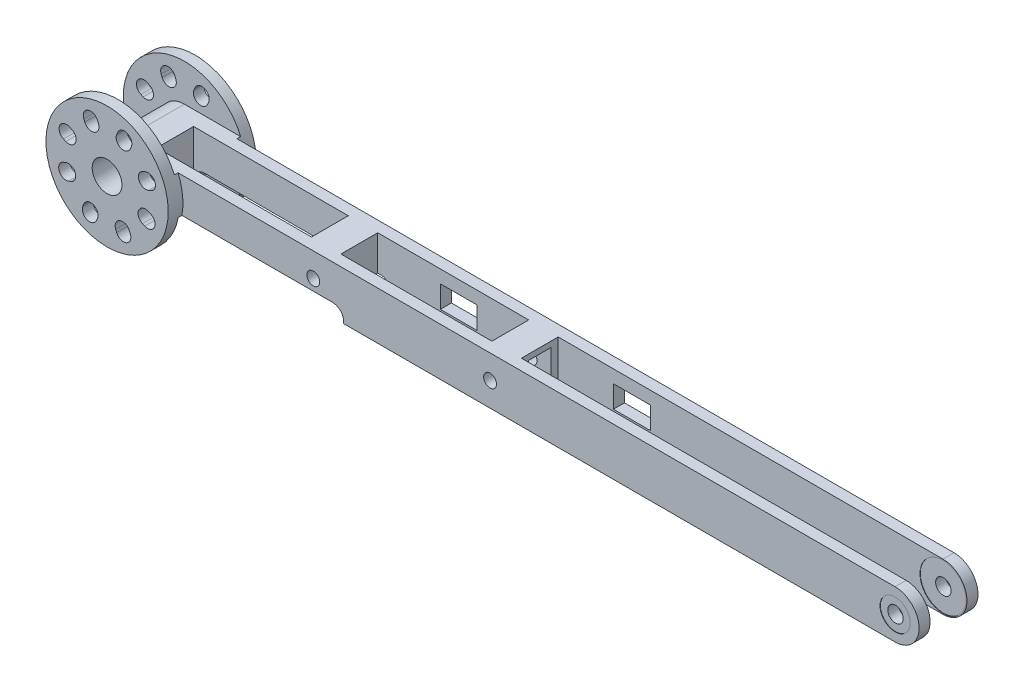
from build123d import *
from build123d.topology import SkipClean

# Parameters (mm, degrees)
SKETCH_1_R          = 4.04
SKETCH_1_R_2        = 1.75
SKETCH_1_R_3        = 2.1
EXTRUDE_1_DEPTH     = 16
SKETCH_2_W          = 42
SKETCH_2_H          = 10
SKETCH_2_W_2        = 41
CUT_EXTRUDE_1_DEPTH = 218.479309361
SKETCH_6_W          = 53.755833771
SKETCH_6_H          = 16
CUT_EXTRUDE_2_DEPTH = 3.5
FILLET_1_R          = 3
EXTRUDE_START       = 1
SKETCH_7_R          = 6.5
SKETCH_7_R_2        = 4.04
EXTRUDE_2_DEPTH     = 1
SKETCH_8_R          = 16.6
SKETCH_8_R_2        = 4.04
EXTRUDE_3_DEPTH     = 3
SKETCH_9_R          = 6.5
SKETCH_9_R_2        = 4.04
EXTRUDE_4_DEPTH     = 1
SKETCH_10_R         = 16.6
SKETCH_10_R_2       = 4.04
EXTRUDE_5_DEPTH     = 2.9
EXTRUDE_7_DEPTH     = 1
EXTRUDE_8_DEPTH     = 1
SKETCH_13_W         = 10
SKETCH_13_H         = 6
CUT_EXTRUDE_3_DEPTH = 10
SKETCH_14_W         = 6
SKETCH_14_H         = 10
CUT_EXTRUDE_4_DEPTH = 10
SKETCH_15_R         = 4.1
A_0P1_DEPTH         = 0.1
B_0P1_START         = -0.1
SKETCH_16_R         = 4.1
B_0P1_DEPTH         = 0.1
SKETCH_17_R         = 6.25
A_0P1_2_DEPTH       = 0.1
SKETCH_18_R         = 6.25
B_0P1_2_DEPTH       = 0.1


with BuildPart() as part:
    # 草图1 → 凸台-拉伸1 (new body)
    with BuildSketch(Plane.XY):
        with BuildLine():
            Line((0, 6.5), (210, 6.5))
            ThreePointArc((210, 6.5), (216.5, 0), (210, -6.5))
            Line((210, -6.5), (0, -6.5))
            ThreePointArc((0, -6.5), (-6.5, 0), (0, 6.5))
        make_face()
        Circle(SKETCH_1_R, mode=Mode.SUBTRACT)
        with Locations((100, 0)):
            Circle(SKETCH_1_R_2, mode=Mode.SUBTRACT)
        with Locations((210, 0)):
            Circle(SKETCH_1_R_3, mode=Mode.SUBTRACT)
        with Locations((52, 0)):
            Circle(SKETCH_1_R_2, mode=Mode.SUBTRACT)
    extrude(amount=-EXTRUDE_1_DEPTH)

    # 草图2 → 切除-拉伸1 (cut, through all)
    with BuildSketch(Plane.XZ.offset(6.5)):
        Polygon((148.5, -3), (153.5, -3), (216.5, -3), (216.5, -13), (153.5, -13), (148.5, -13), (105.5, -13), (105.5, -3), align=None)
        with Locations((27.5, -8)):
            Rectangle(SKETCH_2_W, SKETCH_2_H)
        with Locations((77, -8)):
            Rectangle(SKETCH_2_W_2, SKETCH_2_H)
    extrude(amount=-CUT_EXTRUDE_1_DEPTH, mode=Mode.SUBTRACT)

    # 草图6 → 切除-拉伸2 (cut)
    with BuildSketch(Plane.XZ.offset(6.5)):
        with Locations((33.377916885, -8)):
            Rectangle(SKETCH_6_W, SKETCH_6_H)
    extrude(amount=-CUT_EXTRUDE_2_DEPTH, mode=Mode.SUBTRACT)

    # 圆角1
    fillet_1_edges = [part.edges().sort_by_distance(p)[0] for p in [
        (60.255833771, -3, -1.5),
        (60.255833771, -3, -14.5),
        (6.5, -3, -1.5),
        (6.5, -3, -14.5),
    ]]
    fillet(fillet_1_edges, radius=FILLET_1_R)

    # 草图7 → 凸台-拉伸2 (add)
    with SkipClean():  # the faces are left unmerged after this step: merging them gives an invalid solid
        with BuildSketch(Plane.XY.offset(EXTRUDE_START)):
            Circle(SKETCH_7_R)
            Circle(SKETCH_7_R_2, mode=Mode.SUBTRACT)
        extrude(amount=-EXTRUDE_2_DEPTH)

    # 草图9 → 凸台-拉伸4 (add)
    with SkipClean():  # the faces are left unmerged after this step: merging them gives an invalid solid
        with BuildSketch(Plane(origin=(0, 0, -16), x_dir=(-1, 0, 0), z_dir=(0, 0, -1))):
            with Locations(Location((0, 0, 0), (0, 0, 180))):
                Circle(SKETCH_9_R)
            with Locations(Location((0, 0, 0), (0, 0, 180))):
                Circle(SKETCH_9_R_2, mode=Mode.SUBTRACT)
        extrude(amount=EXTRUDE_4_DEPTH)

    # 草图10 → 凸台-拉伸5 (add)
    with SkipClean():  # the faces are left unmerged after this step: merging them gives an invalid solid
        with BuildSketch(Plane(origin=(0, 0, -17), x_dir=(-1, 0, 0), z_dir=(0, 0, -1))):
            with Locations(Location((0, 0, 0), (0, 0, 180))):
                Circle(SKETCH_10_R)
            with Locations(Location((0, 0, 0), (0, 0, 180))):
                Circle(SKETCH_10_R_2, mode=Mode.SUBTRACT)
            with BuildLine():
                Line((2.342135388, 11.2478621), (2.596863715, 11.885129316))
                ThreePointArc((2.596863715, 11.885129316), (5.196329222, 12.999929331), (6.311129238, 10.400463824))
                Line((6.311129238, 10.400463824), (6.056400911, 9.763196608))
                ThreePointArc((6.056400911, 9.763196608), (3.456935403, 8.648396593), (2.342135388, 11.2478621))
            make_face(mode=Mode.SUBTRACT)
            with BuildLine():
                Line((9.60957938, 6.29729975), (10.240315477, 6.567795592))
                ThreePointArc((10.240315477, 6.567795592), (12.866697816, 5.517978555), (11.816880778, 2.891596216))
                Line((11.816880778, 2.891596216), (11.186144681, 2.621100374))
                ThreePointArc((11.186144681, 2.621100374), (8.559762343, 3.670917412), (9.60957938, 6.29729975))
            make_face(mode=Mode.SUBTRACT)
            with BuildLine():
                Line((11.247862101, -2.342135387), (11.885129316, -2.596863715))
                ThreePointArc((11.885129316, -2.596863715), (12.999929331, -5.196329222), (10.400463824, -6.311129238))
                Line((10.400463824, -6.311129238), (9.763196608, -6.056400911))
                ThreePointArc((9.763196608, -6.056400911), (8.648396593, -3.456935403), (11.247862101, -2.342135387))
            make_face(mode=Mode.SUBTRACT)
            with BuildLine():
                Line((-6.29729975, 9.60957938), (-6.567795592, 10.240315477))
                ThreePointArc((-6.567795592, 10.240315477), (-5.517978555, 12.866697815), (-2.891596216, 11.816880778))
                Line((-2.891596216, 11.816880778), (-2.621100374, 11.186144681))
                ThreePointArc((-2.621100374, 11.186144681), (-3.670917411, 8.559762343), (-6.29729975, 9.60957938))
            make_face(mode=Mode.SUBTRACT)
            with BuildLine():
                Line((6.29729975, -9.60957938), (6.567795592, -10.240315477))
                ThreePointArc((6.567795592, -10.240315477), (5.517978555, -12.866697815), (2.891596216, -11.816880778))
                Line((2.891596216, -11.816880778), (2.621100375, -11.186144681))
                ThreePointArc((2.621100375, -11.186144681), (3.670917412, -8.559762343), (6.29729975, -9.60957938))
            make_face(mode=Mode.SUBTRACT)
            with BuildLine():
                Line((-2.342135387, -11.2478621), (-2.596863714, -11.885129316))
                ThreePointArc((-2.596863714, -11.885129316), (-5.196329222, -12.999929331), (-6.311129238, -10.400463824))
                Line((-6.311129238, -10.400463824), (-6.05640091, -9.763196608))
                ThreePointArc((-6.05640091, -9.763196608), (-3.456935403, -8.648396593), (-2.342135387, -11.2478621))
            make_face(mode=Mode.SUBTRACT)
            with BuildLine():
                Line((-9.60957938, -6.29729975), (-10.240315477, -6.567795592))
                ThreePointArc((-10.240315477, -6.567795592), (-12.866697815, -5.517978555), (-11.816880778, -2.891596216))
                Line((-11.816880778, -2.891596216), (-11.186144681, -2.621100374))
                ThreePointArc((-11.186144681, -2.621100374), (-8.559762342, -3.670917412), (-9.60957938, -6.29729975))
            make_face(mode=Mode.SUBTRACT)
            with BuildLine():
                Line((-11.2478621, 2.342135387), (-11.885129316, 2.596863715))
                ThreePointArc((-11.885129316, 2.596863715), (-12.999929331, 5.196329222), (-10.400463823, 6.311129238))
                Line((-10.400463823, 6.311129238), (-9.763196608, 6.05640091))
                ThreePointArc((-9.763196608, 6.05640091), (-8.648396593, 3.456935403), (-11.2478621, 2.342135387))
            make_face(mode=Mode.SUBTRACT)
        extrude(amount=EXTRUDE_5_DEPTH)



with BuildPart() as body_2:
    # 草图8 → 凸台-拉伸3 (new body)
    with BuildSketch(Plane.XY.offset(1)):
        Circle(SKETCH_8_R)
        Circle(SKETCH_8_R_2, mode=Mode.SUBTRACT)
        with BuildLine():
            Line((9.763196608, 6.056400911), (10.400463823, 6.311129238))
            ThreePointArc((10.400463823, 6.311129238), (11.167664479, 6.453841867), (11.93107922, 6.292096164))
            ThreePointArc((11.93107922, 6.292096164), (13.14264196, 4.429128567), (11.885129315, 2.596863715))
            Line((11.885129315, 2.596863715), (11.2478621, 2.342135387))
            ThreePointArc((11.2478621, 2.342135387), (8.648396592, 3.456935403), (9.763196608, 6.056400911))
        make_face(mode=Mode.SUBTRACT)
        with BuildLine():
            Line((11.186144681, -2.621100374), (11.816880778, -2.891596216))
            ThreePointArc((11.816880778, -2.891596216), (12.460286632, -3.333175934), (12.885730889, -3.987363158))
            ThreePointArc((12.885730889, -3.987363158), (12.425118097, -6.161384408), (10.240315477, -6.567795592))
            Line((10.240315477, -6.567795592), (9.60957938, -6.29729975))
            ThreePointArc((9.60957938, -6.29729975), (8.559762342, -3.670917411), (11.186144681, -2.621100374))
        make_face(mode=Mode.SUBTRACT)
        with BuildLine():
            Line((6.05640091, -9.763196608), (6.311129238, -10.400463823))
            ThreePointArc((6.311129238, -10.400463823), (6.453841867, -11.167664478), (6.292096164, -11.93107922))
            ThreePointArc((6.292096164, -11.93107922), (4.429128567, -13.14264196), (2.596863714, -11.885129315))
            Line((2.596863714, -11.885129315), (2.342135387, -11.2478621))
            ThreePointArc((2.342135387, -11.2478621), (3.456935403, -8.648396592), (6.05640091, -9.763196608))
        make_face(mode=Mode.SUBTRACT)
        with BuildLine():
            Line((-2.621100374, -11.186144681), (-2.891596216, -11.816880778))
            ThreePointArc((-2.891596216, -11.816880778), (-3.333175934, -12.460286631), (-3.987363158, -12.885730889))
            ThreePointArc((-3.987363158, -12.885730889), (-6.161384408, -12.425118097), (-6.567795592, -10.240315476))
            Line((-6.567795592, -10.240315476), (-6.29729975, -9.60957938))
            ThreePointArc((-6.29729975, -9.60957938), (-3.670917412, -8.559762342), (-2.621100374, -11.186144681))
        make_face(mode=Mode.SUBTRACT)
        with BuildLine():
            Line((2.621100374, 11.186144681), (2.891596216, 11.816880778))
            ThreePointArc((2.891596216, 11.816880778), (3.333175934, 12.460286632), (3.987363158, 12.885730889))
            ThreePointArc((3.987363158, 12.885730889), (6.161384408, 12.425118097), (6.567795592, 10.240315477))
            Line((6.567795592, 10.240315477), (6.29729975, 9.60957938))
            ThreePointArc((6.29729975, 9.60957938), (3.670917411, 8.559762343), (2.621100374, 11.186144681))
        make_face(mode=Mode.SUBTRACT)
        with BuildLine():
            Line((-9.763196608, -6.05640091), (-10.400463823, -6.311129238))
            ThreePointArc((-10.400463823, -6.311129238), (-11.167664479, -6.453841867), (-11.93107922, -6.292096164))
            ThreePointArc((-11.93107922, -6.292096164), (-13.14264196, -4.429128567), (-11.885129316, -2.596863714))
            Line((-11.885129316, -2.596863714), (-11.2478621, -2.342135387))
            ThreePointArc((-11.2478621, -2.342135387), (-8.648396593, -3.456935403), (-9.763196608, -6.05640091))
        make_face(mode=Mode.SUBTRACT)
        with BuildLine():
            Line((-11.186144681, 2.621100374), (-11.816880778, 2.891596216))
            ThreePointArc((-11.816880778, 2.891596216), (-12.460286632, 3.333175934), (-12.885730889, 3.987363158))
            ThreePointArc((-12.885730889, 3.987363158), (-12.425118097, 6.161384409), (-10.240315477, 6.567795592))
            Line((-10.240315477, 6.567795592), (-9.60957938, 6.29729975))
            ThreePointArc((-9.60957938, 6.29729975), (-8.559762343, 3.670917412), (-11.186144681, 2.621100374))
        make_face(mode=Mode.SUBTRACT)
        with BuildLine():
            Line((-6.056400911, 9.763196608), (-6.311129238, 10.400463824))
            ThreePointArc((-6.311129238, 10.400463824), (-6.453841867, 11.167664479), (-6.292096164, 11.93107922))
            ThreePointArc((-6.292096164, 11.93107922), (-4.429128567, 13.14264196), (-2.596863715, 11.885129316))
            Line((-2.596863715, 11.885129316), (-2.342135387, 11.2478621))
            ThreePointArc((-2.342135387, 11.2478621), (-3.456935403, 8.648396593), (-6.056400911, 9.763196608))
        make_face(mode=Mode.SUBTRACT)
    extrude(amount=EXTRUDE_3_DEPTH)


with BuildPart() as part_1:
    with SkipClean():  # the faces are left unmerged after this step: merging them gives an invalid solid
        add(part.part)

        add(body_2.part)  # 凸台-拉伸7 merges body 2
        # 草图11 → 凸台-拉伸7 (add)
        with BuildSketch(Plane.XY.offset(EXTRUDE_START)):
            with BuildLine():
                Line((0, -6.5), (6.5, -6.5))
                Line((6.5, -6.5), (6.5, -6))
                ThreePointArc((6.5, -6), (7.378679656, -3.878679656), (9.5, -3))
                Line((9.5, -3), (16.326665306, -3))
                ThreePointArc((16.326665306, -3), (16.499113037, 1.827366682), (15.274488535, 6.5))
                Line((15.274488535, 6.5), (0, 6.5))
                ThreePointArc((0, 6.5), (6.5, 0), (0, -6.5))
            make_face()
        extrude(amount=-EXTRUDE_7_DEPTH)

    # 草图12 → 凸台-拉伸8 (add)
    with SkipClean():  # the faces are left unmerged after this step: merging them gives an invalid solid
        with BuildSketch(Plane(origin=(0, 0, -16), x_dir=(-1, 0, 0), z_dir=(0, 0, -1))):
            with BuildLine():
                Line((0, 6.5), (-15.274488535, 6.5))
                ThreePointArc((-15.274488535, 6.5), (-16.499113037, 1.827366682), (-16.326665306, -3))
                Line((-16.326665306, -3), (-9.5, -3))
                ThreePointArc((-9.5, -3), (-7.378679656, -3.878679656), (-6.5, -6))
                Line((-6.5, -6), (-6.5, -6.5))
                Line((-6.5, -6.5), (0, -6.5))
                ThreePointArc((0, -6.5), (-6.5, 0), (0, 6.5))
            make_face()
        extrude(amount=EXTRUDE_8_DEPTH)

    # 草图13 → 切除-拉伸3 (cut)
    with SkipClean():  # the faces are left unmerged after this step: merging them gives an invalid solid
        with BuildSketch(Plane(origin=(0, 0, -16), x_dir=(-1, 0, 0), z_dir=(0, 0, -1))):
            with Locations((-125.5, 0)):
                Rectangle(SKETCH_13_W, SKETCH_13_H)
            with Locations((-78.5, 0)):
                Rectangle(SKETCH_13_W, SKETCH_13_H)
        extrude(amount=-CUT_EXTRUDE_3_DEPTH, mode=Mode.SUBTRACT)

    # 草图14 → 切除-拉伸4 (cut)
    with SkipClean():  # the faces are left unmerged after this step: merging them gives an invalid solid
        with BuildSketch(Plane(origin=(105.5, 0, 0), x_dir=(0, 0, -1), z_dir=(1, 0, 0))):
            with Locations((8, 0)):
                Rectangle(SKETCH_14_W, SKETCH_14_H)
        extrude(amount=-CUT_EXTRUDE_4_DEPTH, mode=Mode.SUBTRACT)

    # 草图15 → A__0p1 (cut)
    with SkipClean():  # the faces are left unmerged after this step: merging them gives an invalid solid
        with BuildSketch(Plane.XY):
            with Locations((210, 0)):
                Circle(SKETCH_15_R)
        extrude(amount=-A_0P1_DEPTH, mode=Mode.SUBTRACT)

    # 草图16 → B__0p1 (cut)
    with SkipClean():  # the faces are left unmerged after this step: merging them gives an invalid solid
        with BuildSketch(Plane(origin=(0, 0, -16), x_dir=(-1, 0, 0), z_dir=(0, 0, -1)).offset(B_0P1_START)):
            with Locations(Location((-210, 0, 0), (0, 0, 180))):
                Circle(SKETCH_16_R)
        extrude(amount=B_0P1_DEPTH, mode=Mode.SUBTRACT)

    # 草图17 → A__0p1 2 (cut)
    with SkipClean():  # the faces are left unmerged after this step: merging them gives an invalid solid
        with BuildSketch(Plane(origin=(0, 0, -3), x_dir=(-1, 0, 0), z_dir=(0, 0, -1))):
            with Locations((-210, 0)):
                Circle(SKETCH_17_R)
        extrude(amount=-A_0P1_2_DEPTH, mode=Mode.SUBTRACT)

    # 草图18 → B__0p1 2 (cut)
    with SkipClean():  # the faces are left unmerged after this step: merging them gives an invalid solid
        with BuildSketch(Plane.XY.offset(-13).offset(B_0P1_START)):
            with Locations(Location((210, 0, 0), (0, 0, 180))):
                Circle(SKETCH_18_R)
        extrude(amount=B_0P1_2_DEPTH, mode=Mode.SUBTRACT)


solid = part_1.part
